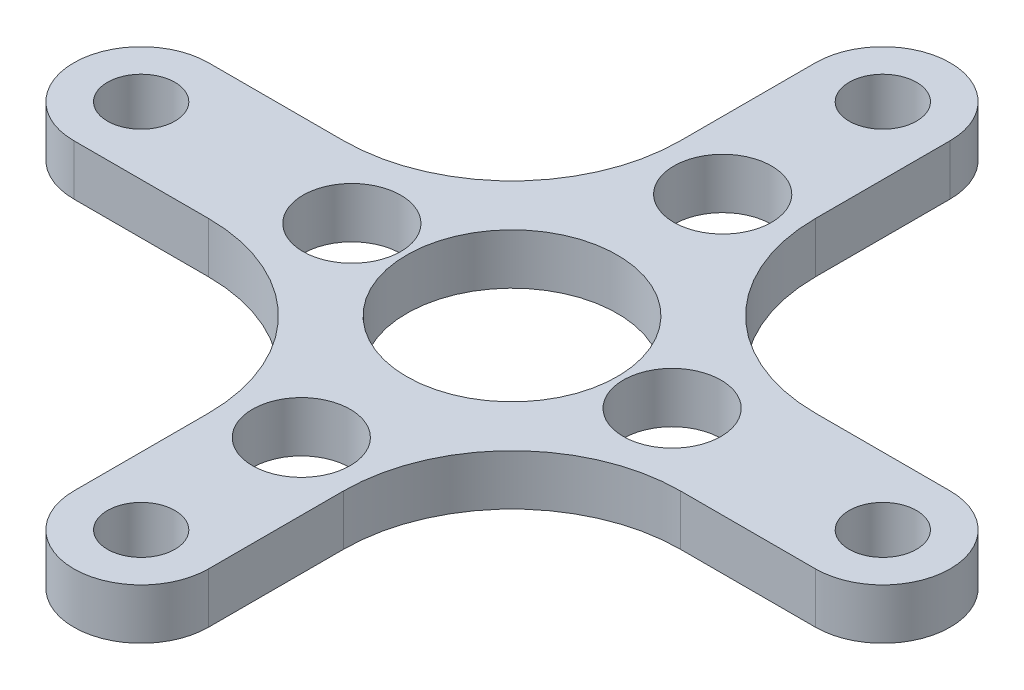
from build123d import *

# Parameters (mm, degrees)
IZIM2_R                     = 2
IZIM2_R_2                   = 2.9
IZIM2_R_3                   = 6.25
Y_KSEKLIK_EKSTR_ZYON1_DEPTH = 3


with BuildPart() as part:
    # Çizim2 → Yükseklik-Ekstrüzyon1 (new body)
    with BuildSketch(Plane(origin=(0, 0, 0), x_dir=(1, 0, 0), z_dir=(0, 1, 0))):
        with BuildLine():
            ThreePointArc((4, 22), (0, 26), (-4, 22))
            Line((-4, 22), (-4, 14))
            ThreePointArc((-4, 14), (-6.928932188, 6.928932188), (-14, 4))
            Line((-14, 4), (-22, 4))
            ThreePointArc((-22, 4), (-26, 0), (-22, -4))
            Line((-22, -4), (-14, -4))
            ThreePointArc((-14, -4), (-6.928932188, -6.928932188), (-4, -14))
            Line((-4, -14), (-4, -22))
            ThreePointArc((-4, -22), (0, -26), (4, -22))
            Line((4, -22), (4, -14))
            ThreePointArc((4, -14), (6.928932188, -6.928932188), (14, -4))
            Line((14, -4), (22, -4))
            ThreePointArc((22, -4), (26, 0), (22, 4))
            Line((22, 4), (14, 4))
            ThreePointArc((14, 4), (6.928932188, 6.928932188), (4, 14))
            Line((4, 14), (4, 22))
        make_face()
        with Locations(Location((0, -22, 0), (0, 0, 270))):
            Circle(IZIM2_R, mode=Mode.SUBTRACT)
        with Locations(Location((0, -12.5, 0), (0, 0, 270))):
            Circle(IZIM2_R_2, mode=Mode.SUBTRACT)
        with Locations(Location((-22, 0, 0), (0, 0, 270))):
            Circle(IZIM2_R, mode=Mode.SUBTRACT)
        with Locations(Location((-9.5, 0, 0), (0, 0, 270))):
            Circle(IZIM2_R_2, mode=Mode.SUBTRACT)
        with Locations(Location((0, 0, 0), (0, 0, 270))):
            Circle(IZIM2_R_3, mode=Mode.SUBTRACT)
        with Locations(Location((9.5, 0, 0), (0, 0, 270))):
            Circle(IZIM2_R_2, mode=Mode.SUBTRACT)
        with Locations(Location((0, 12.5, 0), (0, 0, 270))):
            Circle(IZIM2_R_2, mode=Mode.SUBTRACT)
        with Locations(Location((0, 22, 0), (0, 0, 270))):
            Circle(IZIM2_R, mode=Mode.SUBTRACT)
        with Locations(Location((22, 0, 0), (0, 0, 270))):
            Circle(IZIM2_R, mode=Mode.SUBTRACT)
    extrude(amount=Y_KSEKLIK_EKSTR_ZYON1_DEPTH)


solid = part.part
